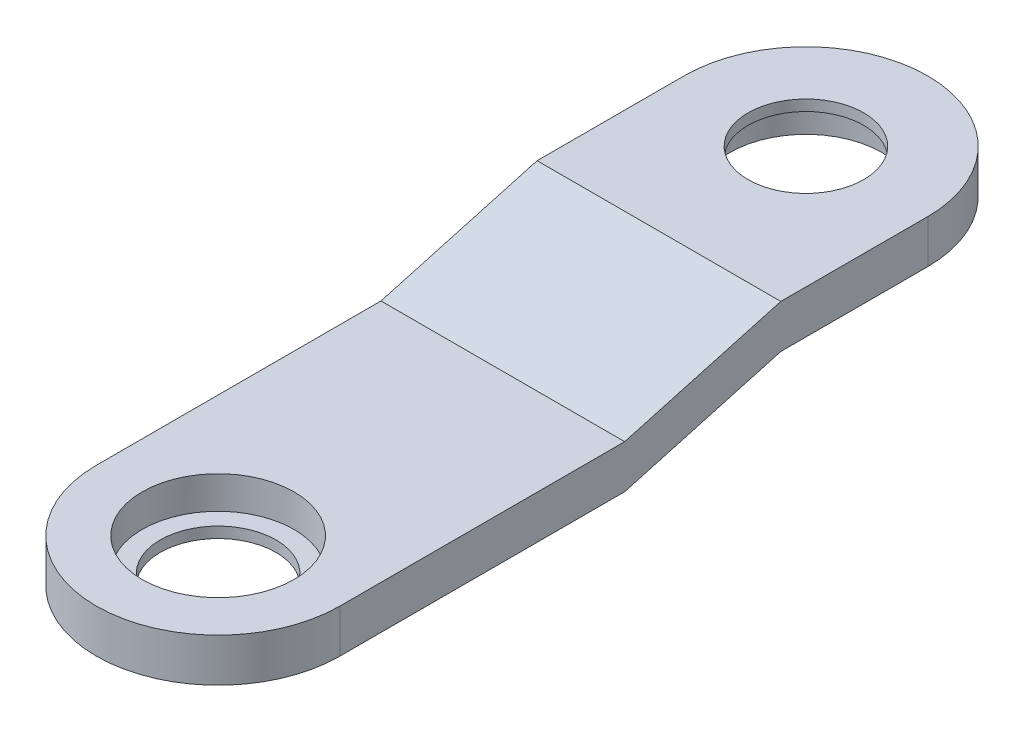
from build123d import *

# Parameters (mm, degrees)
SKETCH1_R           = 10.499999955
BOSS_EXTRUDE1_DEPTH = 12
SKETCH2_R           = 10.499999955
CUT_EXTRUDE1_DEPTH  = 6
BOSS_EXTRUDE2_START = -1.5
SKETCH3_R           = 10.499999955
SKETCH3_R_2         = 8
BOSS_EXTRUDE2_DEPTH = 1.5
CUT_EXTRUDE2_START  = -6
CUT_EXTRUDE2_DEPTH  = 6
SKETCH5_R           = 10.499999955
SKETCH5_R_2         = 8
BOSS_EXTRUDE3_DEPTH = 1.5
CUT_EXTRUDE6_DEPTH  = 105.447053023


with BuildPart() as part:
    # Sketch1 → Boss-Extrude1 (new body)
    with BuildSketch(Plane(origin=(0, 0, 0), x_dir=(1, 0, 0), z_dir=(0, 1, 0))):
        with BuildLine():
            Line((-16.849999955, 0), (-16.849999955, 81.28))
            ThreePointArc((-16.849999955, 81.28), (0, 98.129999955), (16.849999955, 81.28))
            Line((16.849999955, 81.28), (16.849999955, 0))
            ThreePointArc((16.849999955, 0), (0, -16.849999955), (-16.849999955, 0))
        make_face()
        Circle(SKETCH1_R, mode=Mode.SUBTRACT)
        with Locations((0, 81.28)):
            Circle(SKETCH1_R, mode=Mode.SUBTRACT)
    extrude(amount=BOSS_EXTRUDE1_DEPTH)

    # Sketch2 → Cut-Extrude1 (cut)
    with BuildSketch(Plane.XZ):
        with BuildLine():
            Line((-16.849999955, -60.96), (-16.849999955, -81.28))
            ThreePointArc((-16.849999955, -81.28), (0, -98.129999955), (16.849999955, -81.28))
            Line((16.849999955, -81.28), (16.849999955, -60.96))
            Line((16.849999955, -60.96), (-16.849999955, -60.96))
        make_face()
        with Locations((0, -81.28)):
            Circle(SKETCH2_R, mode=Mode.SUBTRACT)
    extrude(amount=-CUT_EXTRUDE1_DEPTH, mode=Mode.SUBTRACT)

    # Sketch3 → Boss-Extrude2 (add)
    with BuildSketch(Plane(origin=(0, 12, 0), x_dir=(1, 0, 0), z_dir=(0, 1, 0)).offset(BOSS_EXTRUDE2_START)):
        with Locations((0, 81.28)):
            Circle(SKETCH3_R)
        with Locations((0, 81.28)):
            Circle(SKETCH3_R_2, mode=Mode.SUBTRACT)
    extrude(amount=BOSS_EXTRUDE2_DEPTH)

    # Sketch4 → Cut-Extrude2 (cut)
    with BuildSketch(Plane(origin=(0, 12, 0), x_dir=(1, 0, 0), z_dir=(0, 1, 0)).offset(CUT_EXTRUDE2_START)):
        with BuildLine():
            Line((-16.849999955, 0), (-16.849999955, 20.32))
            Line((-16.849999955, 20.32), (16.849999955, 20.32))
            Line((16.849999955, 20.32), (16.849999955, 0))
            ThreePointArc((16.849999955, 0), (0, -16.849999955), (-16.849999955, 0))
        make_face()
    extrude(amount=CUT_EXTRUDE2_DEPTH, mode=Mode.SUBTRACT)

    # Sketch5 → Boss-Extrude3 (add)
    with BuildSketch(Plane.XZ):
        Circle(SKETCH5_R)
        Circle(SKETCH5_R_2, mode=Mode.SUBTRACT)
    extrude(amount=-BOSS_EXTRUDE3_DEPTH)

    # Sketch8 → Cut-Extrude6 (cut, through all)
    with BuildSketch(Plane(origin=(-16.849999955, 0, 0), x_dir=(0, 0, -1), z_dir=(1, 0, 0))):
        Polygon((20.32, 6), (39.37, 6), (60.96, 12), (20.32, 12), align=None)
        Polygon((60.96, 6), (39.37, 0), (60.96, 0), align=None)
    extrude(amount=CUT_EXTRUDE6_DEPTH, mode=Mode.SUBTRACT)


solid = part.part
